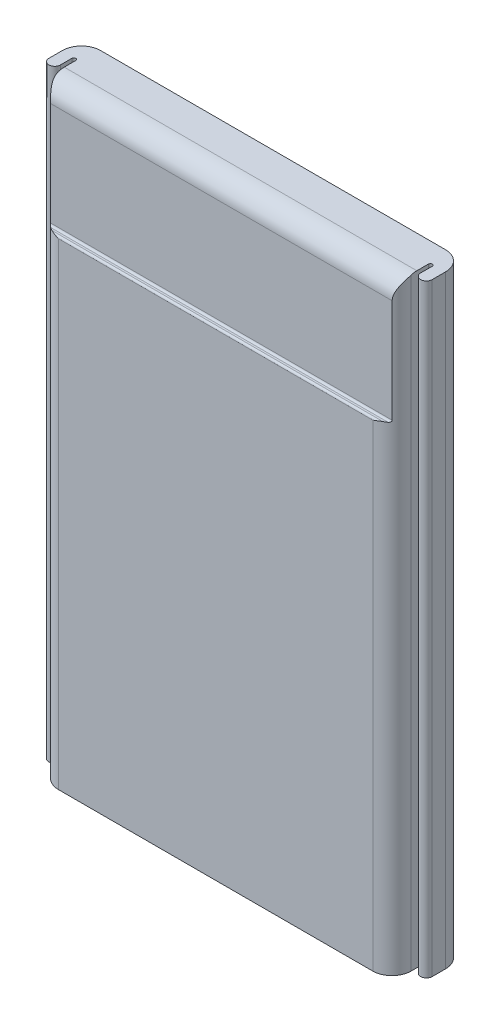
from build123d import *

# Parameters (mm, degrees)
EXTRUDE_1_DEPTH                 = 15.75
CUT_EXTRUDE_1_REACH             = 20.896
CUT_EXTRUDE_1_DIRECTION_2_REACH = 20.896


with BuildPart() as part:
    # Эскиз1 → Бобышка-Вытянуть1 (new, symmetric)
    with BuildSketch(Plane(origin=(0, 0, 0), x_dir=(1, 0, 0), z_dir=(0, 1, 0))):
        with BuildLine():
            Line((-9, 0), (9, 0))
            ThreePointArc((9, 0), (9.707106781, -0.292893219), (10, -1))
            Line((10, -1), (10, -1.7))
            ThreePointArc((10, -1.7), (9.7, -2), (9.4, -1.7))
            Line((9.4, -1.7), (9.4, -1.1))
            ThreePointArc((9.4, -1.1), (9.3, -1), (9.2, -1.1))
            Line((9.2, -1.1), (9.2, -2))
            ThreePointArc((9.2, -2), (8.907106781, -2.707106781), (8.2, -3))
            Line((8.2, -3), (-8.2, -3))
            ThreePointArc((-8.2, -3), (-8.907106781, -2.707106781), (-9.2, -2))
            Line((-9.2, -2), (-9.2, -1.1))
            ThreePointArc((-9.2, -1.1), (-9.3, -1), (-9.4, -1.1))
            Line((-9.4, -1.1), (-9.4, -1.7))
            ThreePointArc((-9.4, -1.7), (-9.7, -2), (-10, -1.7))
            Line((-10, -1.7), (-10, -1))
            ThreePointArc((-10, -1), (-9.707106781, -0.292893219), (-9, 0))
        make_face()
    extrude(amount=EXTRUDE_1_DEPTH, both=True)

    # Эскиз2 → Вырез-Вытянуть1 (cut, up to next)
    with BuildSketch(Plane(origin=(0, 0, 0), x_dir=(0, 0, -1), z_dir=(1, 0, 0)), mode=Mode.PRIVATE) as cut_extrude_1_sk1:
        with BuildLine():
            Line((-2.7, 14.75), (-2.7, 9.35))
            ThreePointArc((-2.7, 9.35), (-2.729289322, 9.279289322), (-2.8, 9.25))
            Line((-2.8, 9.25), (-2.9, 9.25))
            ThreePointArc((-2.9, 9.25), (-2.970710678, 9.220710678), (-3, 9.15))
            Line((-3, 9.15), (-3, 15.75))
            Line((-3, 15.75), (-1.7, 15.75))
            ThreePointArc((-1.7, 15.75), (-2.407106781, 15.457106781), (-2.7, 14.75))
        make_face()
    cut_extrude_1_tool1 = extrude(cut_extrude_1_sk1.sketch, amount=-CUT_EXTRUDE_1_REACH, mode=Mode.PRIVATE) & part.part
    add(cut_extrude_1_tool1.solids().sort_by_distance((0, 12.800021, 2.813237))[0], mode=Mode.SUBTRACT)

    # Эскиз2 → Вырез-Вытянуть1 direction 2 (cut, up to next)
    with BuildSketch(Plane(origin=(0, 0, 0), x_dir=(0, 0, -1), z_dir=(1, 0, 0)), mode=Mode.PRIVATE) as cut_extrude_1_direction_2_sk1:
        with BuildLine():
            Line((-2.7, 14.75), (-2.7, 9.35))
            ThreePointArc((-2.7, 9.35), (-2.729289322, 9.279289322), (-2.8, 9.25))
            Line((-2.8, 9.25), (-2.9, 9.25))
            ThreePointArc((-2.9, 9.25), (-2.970710678, 9.220710678), (-3, 9.15))
            Line((-3, 9.15), (-3, 15.75))
            Line((-3, 15.75), (-1.7, 15.75))
            ThreePointArc((-1.7, 15.75), (-2.407106781, 15.457106781), (-2.7, 14.75))
        make_face()
    cut_extrude_1_direction_2_tool1 = extrude(cut_extrude_1_direction_2_sk1.sketch, amount=CUT_EXTRUDE_1_DIRECTION_2_REACH, mode=Mode.PRIVATE) & part.part
    add(cut_extrude_1_direction_2_tool1.solids().sort_by_distance((0, 12.800021, 2.813237))[0], mode=Mode.SUBTRACT)


solid = part.part
